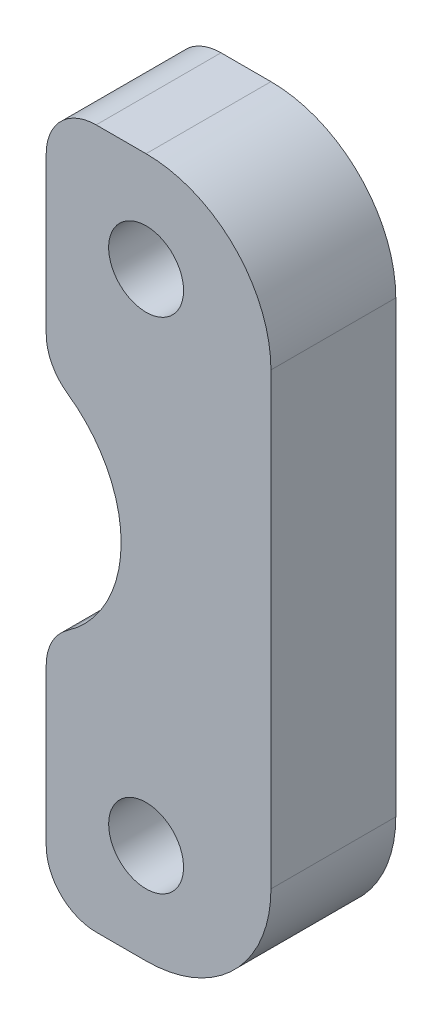
from build123d import *

# Parameters (mm, degrees)
ESQUISSE1_R        = 1.5
BOSS_EXTRU_1_DEPTH = 5
CONG_1_R           = 5
CONG_2_R           = 2


with BuildPart() as part:
    # Esquisse1 → Boss.-Extru.1 (new body)
    with BuildSketch(Plane.XY):
        with BuildLine():
            Line((2, 14), (2, 4.582575695))
            ThreePointArc((2, 4.582575695), (5, 0), (2, -4.582575695))
            Line((2, -4.582575695), (2, -14))
            Line((2, -14), (11, -14))
            Line((11, -14), (11, 14))
            Line((11, 14), (2, 14))
        make_face()
        with Locations((6, 10)):
            Circle(ESQUISSE1_R, mode=Mode.SUBTRACT)
        with Locations(Location((6, -10, 0), (0, 0, 180))):
            Circle(ESQUISSE1_R, mode=Mode.SUBTRACT)
    extrude(amount=BOSS_EXTRU_1_DEPTH)

    # Congé1
    cong_1_edges = [part.edges().sort_by_distance(p)[0] for p in [
        (11, 14, 2.5),
        (11, -14, 2.5),
    ]]
    fillet(cong_1_edges, radius=CONG_1_R)

    # Congé2
    cong_2_edges = [part.edges().sort_by_distance(p)[0] for p in [
        (2, -14, 2.5),
        (2, -4.582575695, 2.5),
        (2, 4.582575695, 2.5),
        (2, 14, 2.5),
    ]]
    fillet(cong_2_edges, radius=CONG_2_R)


solid = part.part
